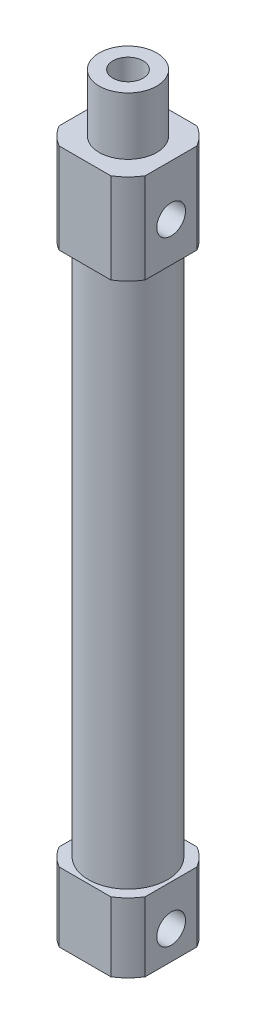
from build123d import *

# Parameters (mm, degrees)
SKETCH_1_W          = 12
SKETCH_1_H          = 12
EXTRUDE_1_DEPTH     = 9.64
SKETCH_2_R          = 5.5
EXTRUDE_2_DEPTH     = 74.3
SKETCH_3_W          = 12
SKETCH_3_H          = 12
EXTRUDE_3_DEPTH     = 12.55
SKETCH_4_R          = 4
EXTRUDE_4_DEPTH     = 8
SKETCH_5_R          = 2.1
CUT_EXTRUDE_1_DEPTH = 94
SKETCH_6_R          = 10.507277245
SKETCH_6_R_2        = 7
CUT_EXTRUDE_2_DEPTH = 102
SKETCH_7_R          = 2
CUT_EXTRUDE_3_DEPTH = 6


with BuildPart() as part:
    # 草图1 → 凸台-拉伸1 (new body)
    with BuildSketch(Plane(origin=(0, 0, 0), x_dir=(1, 0, 0), z_dir=(0, 1, 0))):
        Rectangle(SKETCH_1_W, SKETCH_1_H)
    extrude(amount=EXTRUDE_1_DEPTH)

    # 草图2 → 凸台-拉伸2 (add)
    with BuildSketch(Plane(origin=(0, 9.64, 0), x_dir=(1, 0, 0), z_dir=(0, 1, 0))):
        Circle(SKETCH_2_R)
    extrude(amount=EXTRUDE_2_DEPTH)

    # 草图3 → 凸台-拉伸3 (add)
    with BuildSketch(Plane(origin=(0, 83.94, 0), x_dir=(1, 0, 0), z_dir=(0, 1, 0))):
        Rectangle(SKETCH_3_W, SKETCH_3_H)
    extrude(amount=EXTRUDE_3_DEPTH)

    # 草图4 → 凸台-拉伸4 (add)
    with BuildSketch(Plane(origin=(0, 96.49, 0), x_dir=(1, 0, 0), z_dir=(0, 1, 0))):
        Circle(SKETCH_4_R)
    extrude(amount=EXTRUDE_4_DEPTH)

    # 草图5 → 切除-拉伸1 (cut)
    with BuildSketch(Plane(origin=(0, 104.49, 0), x_dir=(1, 0, 0), z_dir=(0, 1, 0))):
        Circle(SKETCH_5_R)
    extrude(amount=-CUT_EXTRUDE_1_DEPTH, mode=Mode.SUBTRACT)

    # 草图6 → 切除-拉伸2 (cut)
    with BuildSketch(Plane(origin=(0, 96.49, 0), x_dir=(1, 0, 0), z_dir=(0, 1, 0))):
        Circle(SKETCH_6_R)
        Circle(SKETCH_6_R_2, mode=Mode.SUBTRACT)
    extrude(amount=-CUT_EXTRUDE_2_DEPTH, mode=Mode.SUBTRACT)

    # 草图7 → 切除-拉伸3 (cut)
    with BuildSketch(Plane(origin=(6, 0, 0), x_dir=(0, 0, -1), z_dir=(1, 0, 0))):
        with Locations((0, 4)):
            Circle(SKETCH_7_R)
        with Locations((0, 89.44)):
            Circle(SKETCH_7_R)
    extrude(amount=-CUT_EXTRUDE_3_DEPTH, mode=Mode.SUBTRACT)


solid = part.part
